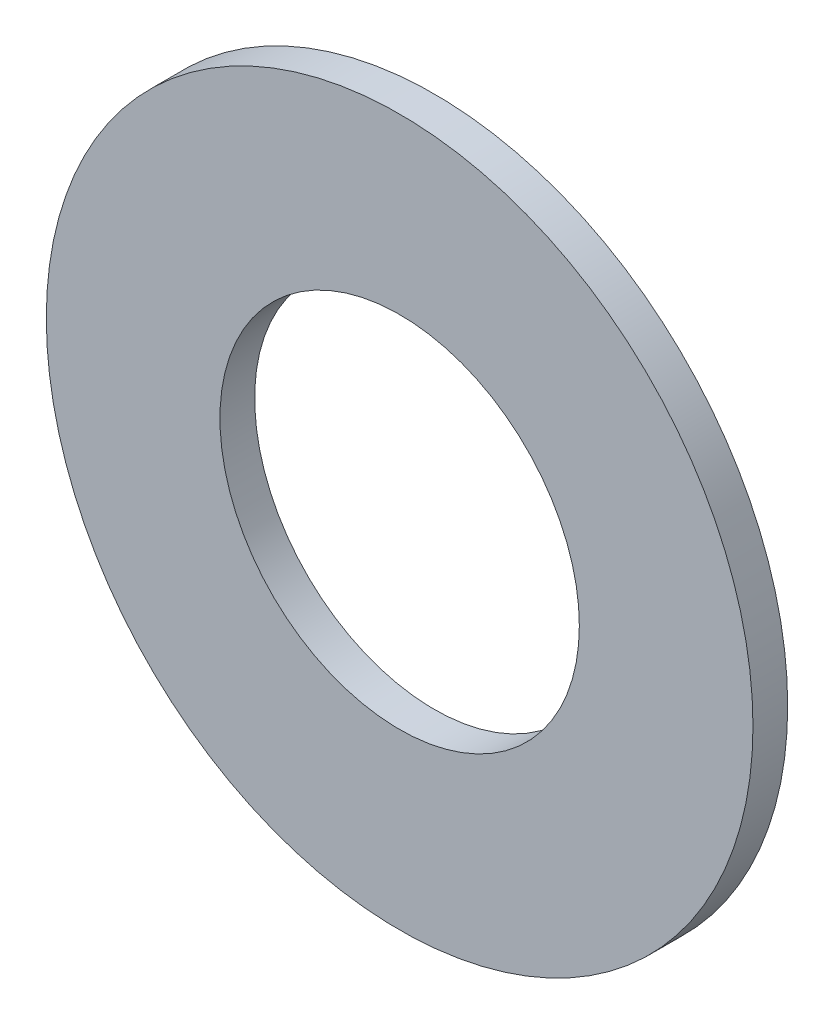
from build123d import *

# Parameters (mm, degrees)
SKETCH1_R           = 25.8445
SKETCH1_R_2         = 13.1445
BOSS_EXTRUDE2_DEPTH = 2.54


with BuildPart() as part:
    # Sketch1 → Boss-Extrude2 (new body)
    with BuildSketch(Plane.XY):
        Circle(SKETCH1_R)
        Circle(SKETCH1_R_2, mode=Mode.SUBTRACT)
    extrude(amount=BOSS_EXTRUDE2_DEPTH)


solid = part.part
